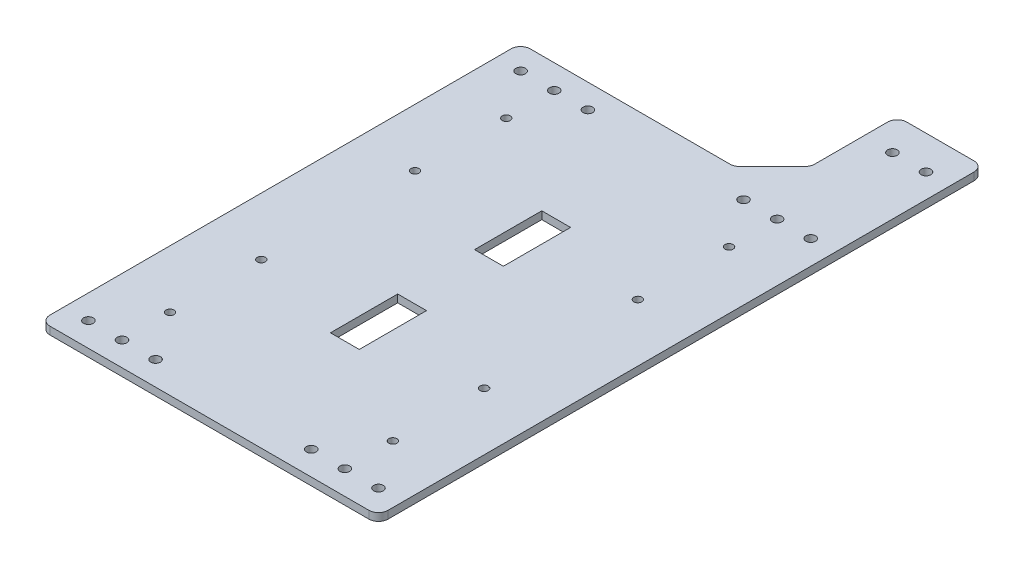
from build123d import *

# Parameters (mm, degrees)
BOSS_EXTRUDE1_DEPTH = 4
SKETCH2_R           = 2.5
SKETCH2_R_2         = 2.1
CUT_EXTRUDE1_DEPTH  = 227.373585031
SKETCH3_W           = 15
SKETCH3_H           = 35
CUT_EXTRUDE2_DEPTH  = 227.373585031
SKETCH4_R           = 2.1
CUT_EXTRUDE3_DEPTH  = 10
CHAMFER1_SIZE       = 20
FILLET1_R           = 5


with BuildPart() as part:
    # Sketch1 → Boss-Extrude1 (new body)
    with BuildSketch(Plane(origin=(0, 0, 0), x_dir=(1, 0, 0), z_dir=(0, 1, 0))):
        Polygon((-123, 125), (8, 125), (8, 190), (53, 190), (53, 125), (53, -125), (-53, -125), (-123, -125), align=None)
    extrude(amount=BOSS_EXTRUDE1_DEPTH)

    # Sketch2 → Cut-Extrude1 (cut, through all)
    with BuildSketch(Plane(origin=(0, 4, 0), x_dir=(1, 0, 0), z_dir=(0, 1, 0))):
        with Locations(Location((-110.5, -112.5, 0), (0, 0, 270))):
            Circle(SKETCH2_R)
        with Locations(Location((-75.5, -112.5, 0), (0, 0, 270))):
            Circle(SKETCH2_R)
        with Locations(Location((-93, -112.5, 0), (0, 0, 270))):
            Circle(SKETCH2_R)
        with Locations(Location((-93, -87.5, 0), (0, 0, 270))):
            Circle(SKETCH2_R_2)
        with Locations(Location((5.5, -112.5, 0), (0, 0, 270))):
            Circle(SKETCH2_R)
        with Locations(Location((23, -112.5, 0), (0, 0, 270))):
            Circle(SKETCH2_R)
        with Locations(Location((40.5, -112.5, 0), (0, 0, 270))):
            Circle(SKETCH2_R)
        with Locations(Location((23, -87.5, 0), (0, 0, 270))):
            Circle(SKETCH2_R_2)
        with Locations(Location((23, 87.5, 0), (0, 0, 90))):
            Circle(SKETCH2_R_2)
        with Locations(Location((40.5, 112.5, 0), (0, 0, 90))):
            Circle(SKETCH2_R)
        with Locations(Location((23, 112.5, 0), (0, 0, 90))):
            Circle(SKETCH2_R)
        with Locations(Location((5.5, 112.5, 0), (0, 0, 90))):
            Circle(SKETCH2_R)
        with Locations(Location((-93, 87.5, 0), (0, 0, 90))):
            Circle(SKETCH2_R_2)
        with Locations(Location((-93, 112.5, 0), (0, 0, 90))):
            Circle(SKETCH2_R)
        with Locations(Location((-75.5, 112.5, 0), (0, 0, 90))):
            Circle(SKETCH2_R)
        with Locations(Location((-110.5, 112.5, 0), (0, 0, 90))):
            Circle(SKETCH2_R)
        with Locations(Location((40.5, 172.5, 0), (0, 0, 270))):
            Circle(SKETCH2_R)
        with Locations(Location((23, 172.5, 0), (0, 0, 270))):
            Circle(SKETCH2_R)
    extrude(amount=-CUT_EXTRUDE1_DEPTH, mode=Mode.SUBTRACT)

    # Sketch3 → Cut-Extrude2 (cut, through all)
    with BuildSketch(Plane.XZ):
        with Locations((-34.5, 37.5)):
            Rectangle(SKETCH3_W, SKETCH3_H)
        with Locations((-34.5, -37.5)):
            Rectangle(SKETCH3_W, SKETCH3_H)
    extrude(amount=-CUT_EXTRUDE2_DEPTH, mode=Mode.SUBTRACT)

    # Sketch4 → Cut-Extrude3 (cut)
    with BuildSketch(Plane.XZ):
        with Locations(Location((-93, 40, 0), (0, 0, 270))):
            Circle(SKETCH4_R)
        with Locations(Location((-93, -40, 0), (0, 0, 90))):
            Circle(SKETCH4_R)
        with Locations(Location((23, -40, 0), (0, 0, 270))):
            Circle(SKETCH4_R)
        with Locations(Location((23, 40, 0), (0, 0, 90))):
            Circle(SKETCH4_R)
    extrude(amount=-CUT_EXTRUDE3_DEPTH, mode=Mode.SUBTRACT)

    # Chamfer1
    chamfer1_edges = [part.edges().sort_by_distance(p)[0] for p in [
        (8, 2, -125),
    ]]
    chamfer(chamfer1_edges, length=CHAMFER1_SIZE)

    # Fillet1
    fillet1_edges = [part.edges().sort_by_distance(p)[0] for p in [
        (-123, 2, -125),
        (8, 2, -190),
        (53, 2, -190),
        (53, 2, 125),
        (-123, 2, 125),
        (-12, 2, -125),
        (8, 2, -145),
    ]]
    fillet(fillet1_edges, radius=FILLET1_R)


solid = part.part
